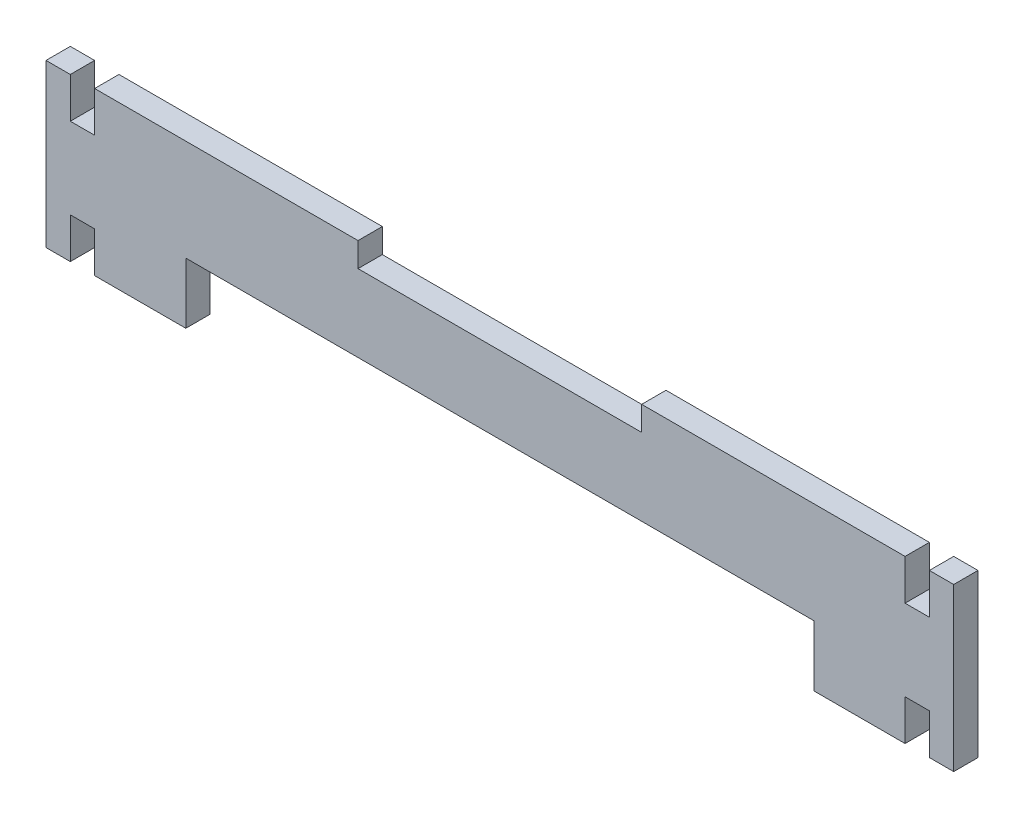
from build123d import *

# Parameters (mm, degrees)
SKETCH1_W            = 224
SKETCH1_H            = 40
BOSS_EXTRUDE1_DEPTH  = 6
SKETCH2_W            = 6
SKETCH2_H            = 10
CUT_EXTRUDE1_DEPTH   = 228.622494495
LPATTERN1_COUNT      = 2
LPATTERN1_PITCH      = 206
LPATTERN1_COUNT_DIR2 = 2
LPATTERN1_PITCH_DIR2 = 30
SKETCH3_W            = 70
SKETCH3_H            = 6
CUT_EXTRUDE2_DEPTH   = 228.622494495
SKETCH4_W            = 155
SKETCH4_H            = 15
CUT_EXTRUDE3_DEPTH   = 10


with BuildPart() as part:
    # Sketch1 → Boss-Extrude1 (new body)
    with BuildSketch(Plane.XY):
        with Locations((-112, 20)):
            Rectangle(SKETCH1_W, SKETCH1_H)
    extrude(amount=BOSS_EXTRUDE1_DEPTH)

    # Sketch2 → Cut-Extrude1 (cut, through all)
    with BuildSketch(Plane.XY.offset(6)):
        with Locations((-215, 35)):
            Rectangle(SKETCH2_W, SKETCH2_H)
    cut_extrude1 = extrude(amount=-CUT_EXTRUDE1_DEPTH, mode=Mode.SUBTRACT)

    # LPattern1: Cut-Extrude1 2 × 2
    with Locations(*[(i * LPATTERN1_PITCH, -j * LPATTERN1_PITCH_DIR2, 0) for i in range(LPATTERN1_COUNT) for j in range(LPATTERN1_COUNT_DIR2) if (i, j) != (0, 0)]):
        add(cut_extrude1, mode=Mode.SUBTRACT)

    # Sketch3 → Cut-Extrude2 (cut, through all)
    with BuildSketch(Plane.XY.offset(6)):
        with Locations((-112, 37)):
            Rectangle(SKETCH3_W, SKETCH3_H)
    extrude(amount=-CUT_EXTRUDE2_DEPTH, mode=Mode.SUBTRACT)

    # Sketch4 → Cut-Extrude3 (cut)
    with BuildSketch(Plane.XY.offset(6)):
        with Locations((-112, 7.5)):
            Rectangle(SKETCH4_W, SKETCH4_H)
    extrude(amount=-CUT_EXTRUDE3_DEPTH, mode=Mode.SUBTRACT)


solid = part.part
